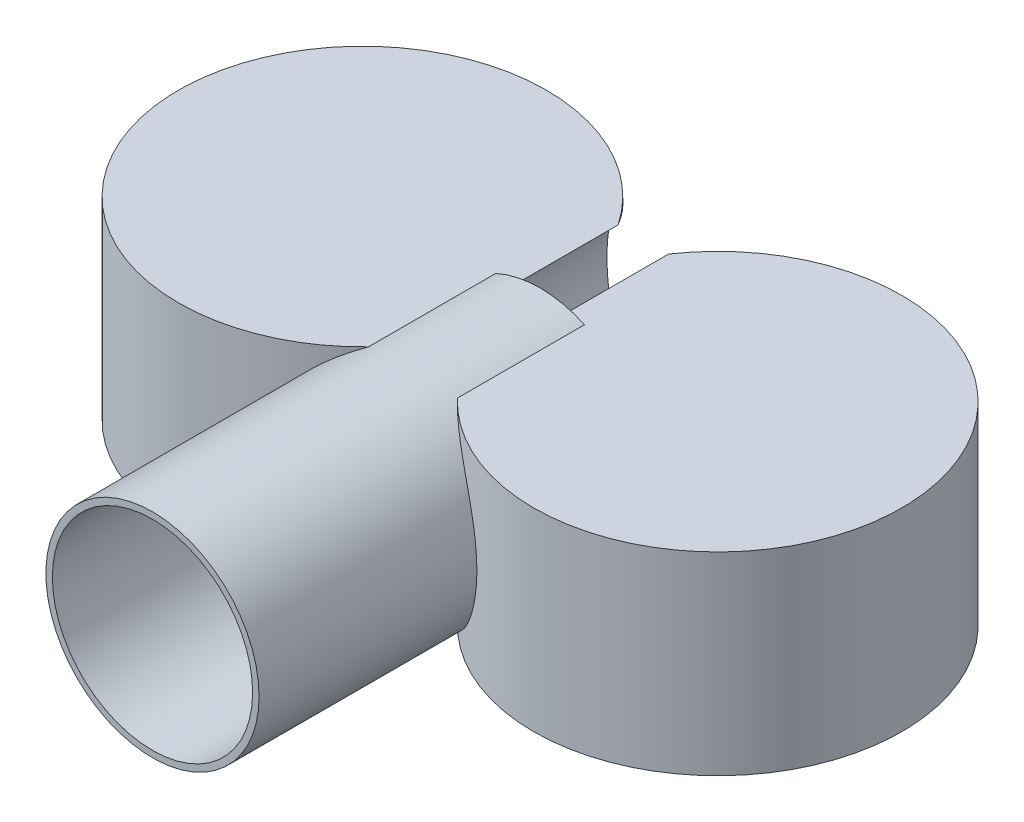
from build123d import *

# Parameters (mm, degrees)
BOSS_EXTRUDE1_DEPTH = 30
SKETCH2_R           = 16.5
BOSS_EXTRUDE2_DEPTH = 60
SKETCH3_R           = 15.5
CUT_EXTRUDE1_DEPTH  = 118.763469435


with BuildPart() as part:
    # Sketch1 → Boss-Extrude1 (new body)
    with BuildSketch(Plane(origin=(0, 0, 0), x_dir=(1, 0, 0), z_dir=(0, 1, 0))):
        with BuildLine():
            ThreePointArc((-15.019255805, 7.483314774), (-71.019255805, 0), (-15.019255805, -7.483314774))
            ThreePointArc((-15.019255805, -7.483314774), (40.980744195, 0), (-15.019255805, 7.483314774))
        make_face()
    extrude(amount=BOSS_EXTRUDE1_DEPTH)

    # Sketch2 → Boss-Extrude2 (add)
    with BuildSketch(Plane.XY):
        with Locations(Location((-15.019255805, 15, 0), (0, 0, 245.380019443))):
            Circle(SKETCH2_R)
    extrude(amount=BOSS_EXTRUDE2_DEPTH)

    # Sketch3 → Cut-Extrude1 (cut, through all)
    with BuildSketch(Plane.XY.offset(60)):
        with Locations((-15.019255805, 15)):
            Circle(SKETCH3_R)
    extrude(amount=-CUT_EXTRUDE1_DEPTH, mode=Mode.SUBTRACT)


solid = part.part
